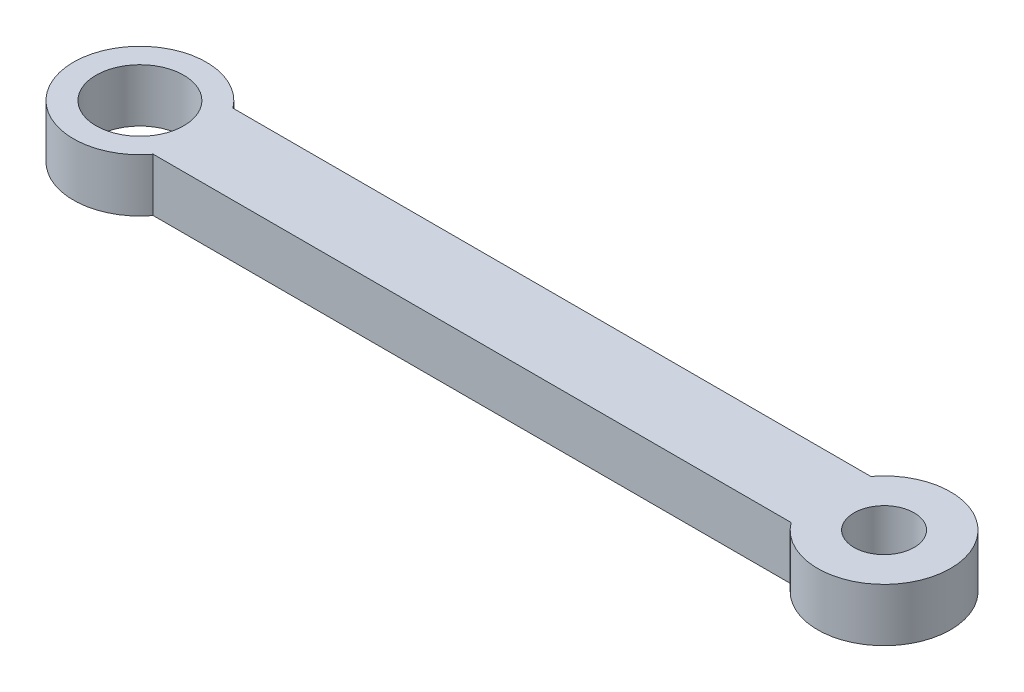
from build123d import *

# Parameters (mm, degrees)
SKETCH1_R           = 1.65
SKETCH1_R_2         = 1.1303
BOSS_EXTRUDE1_DEPTH = 2


with BuildPart() as part:
    # Sketch1 → Boss-Extrude1 (new body)
    with BuildSketch(Plane(origin=(0, 0, 0), x_dir=(1, 0, 0), z_dir=(0, 1, 0))):
        with BuildLine():
            Line((-12, 1.5), (12, 1.5))
            ThreePointArc((12, 1.5), (16.5, 0), (12, -1.5))
            Line((12, -1.5), (-12, -1.5))
            ThreePointArc((-12, -1.5), (-16.5, 0), (-12, 1.5))
        make_face()
        with Locations(Location((-14, 0, 0), (0, 0, 270))):
            Circle(SKETCH1_R, mode=Mode.SUBTRACT)
        with Locations(Location((14, 0, 0), (0, 0, 270))):
            Circle(SKETCH1_R_2, mode=Mode.SUBTRACT)
    extrude(amount=BOSS_EXTRUDE1_DEPTH)


solid = part.part
